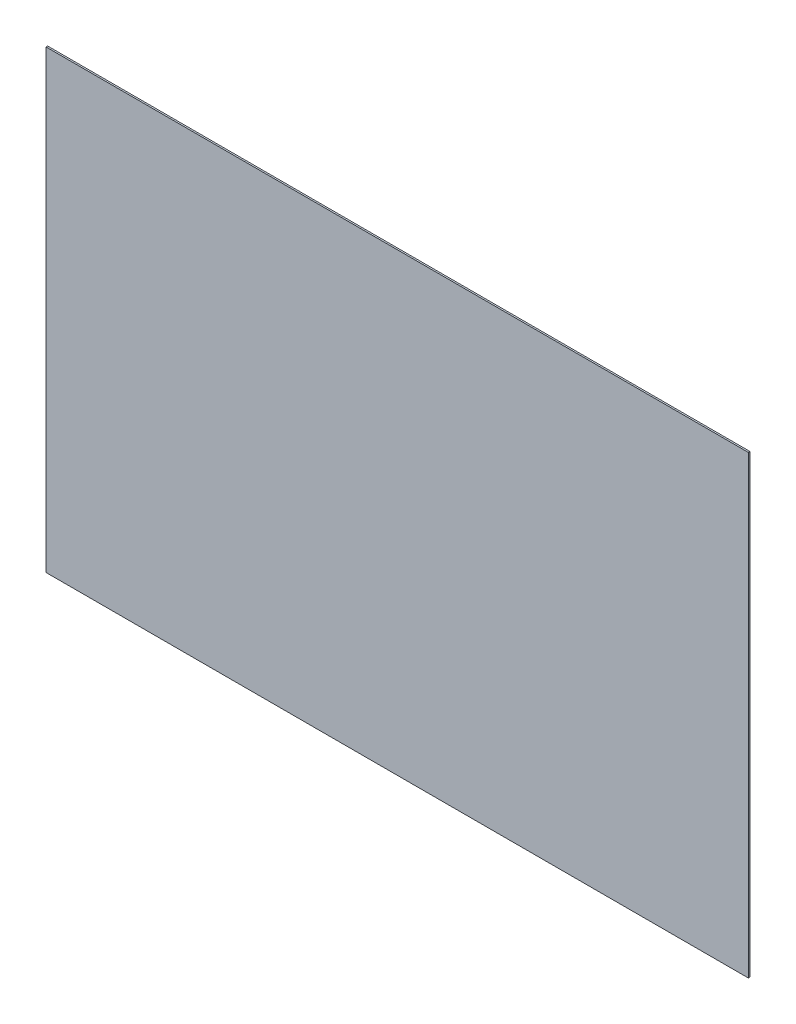
from build123d import *

# Parameters (mm, degrees)
SKETCH1_W           = 685.8
SKETCH1_H           = 444.5
BOSS_EXTRUDE1_DEPTH = 1.5875


with BuildPart() as part:
    # Sketch1 → Boss-Extrude1 (new body)
    with BuildSketch(Plane.XY):
        with Locations((-342.9, 222.25)):
            Rectangle(SKETCH1_W, SKETCH1_H)
    extrude(amount=BOSS_EXTRUDE1_DEPTH)


solid = part.part
